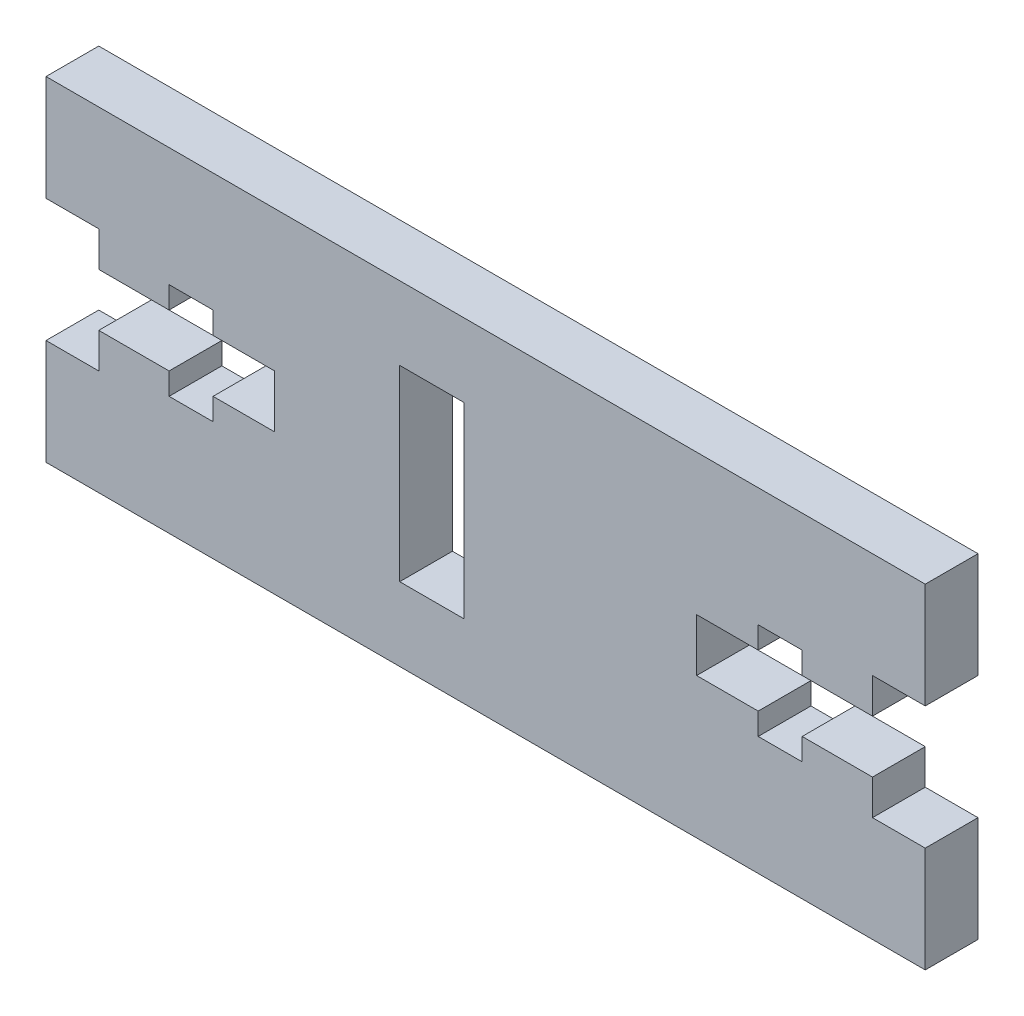
from build123d import *

# Parameters (mm, degrees)
SKETCH_1_W      = 3.660528642
SKETCH_1_H      = 10.65279893
EXTRUDE_1_DEPTH = 3


with BuildPart() as part:
    # 草图1 → 凸台-拉伸1 (new body)
    with BuildSketch(Plane.XY.offset(3)):
        Polygon((45.580049157, 0), (45.580049157, 5.99999), (42.580009157, 5.99999), (42.580009157, 7.99949), (38.581009157, 7.99949), (38.581009157, 6.74959), (36.079809157, 6.74959), (36.079809157, 7.99949), (32.580009157, 7.99949), (32.580009157, 10.99949), (36.079809157, 10.99949), (36.079809157, 12.25079), (38.581009157, 12.25079), (38.581009157, 10.99949), (42.580009157, 10.99949), (42.580009157, 13.00039), (45.580049157, 13.00039), (45.580049157, 19.00039), (-4.419390843, 19.00039), (-4.419390843, 13.00039), (-1.419350843, 13.00039), (-1.419350843, 10.99949), (2.579649157, 10.99949), (2.579649157, 12.25079), (5.080849157, 12.25079), (5.080849157, 10.99949), (8.580649157, 10.99949), (8.580649157, 7.99949), (5.080849157, 7.99949), (5.080849157, 6.74959), (2.579649157, 6.74959), (2.579649157, 7.99949), (-1.419350843, 7.99949), (-1.419350843, 5.99999), (-4.419390843, 5.99999), (-4.419390843, 0), align=None)
        with Locations((17.524355382, 9.504123146)):
            Rectangle(SKETCH_1_W, SKETCH_1_H, mode=Mode.SUBTRACT)
    extrude(amount=-EXTRUDE_1_DEPTH)


solid = part.part
